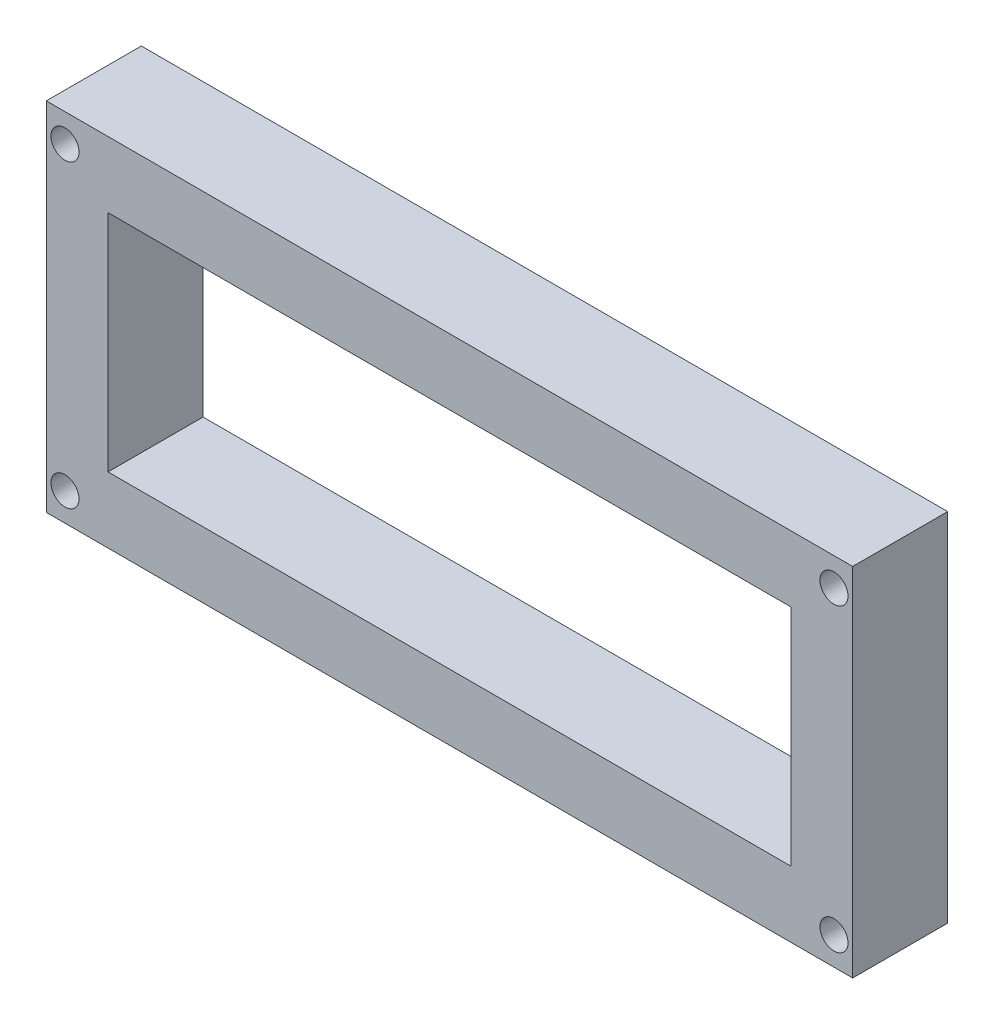
from build123d import *

# Parameters (mm, degrees)
SKETCH1_W           = 86.199999926
SKETCH1_H           = 38.1
SKETCH1_W_2         = 73
SKETCH1_H_2         = 24
BOSS_EXTRUDE1_DEPTH = 10.16
SKETCH2_R           = 1.5
CUT_EXTRUDE1_DEPTH  = 10.16


with BuildPart() as part:
    # Sketch1 → Boss-Extrude1 (new body)
    with BuildSketch(Plane.XY):
        Rectangle(SKETCH1_W, SKETCH1_H)
        Rectangle(SKETCH1_W_2, SKETCH1_H_2, mode=Mode.SUBTRACT)
    extrude(amount=BOSS_EXTRUDE1_DEPTH)

    # Sketch2 → Cut-Extrude1 (cut)
    with BuildSketch(Plane.XY.offset(10.16)):
        with Locations((41.099999963, 16.05)):
            Circle(SKETCH2_R)
        with Locations(Location((-41.099999963, 16.05, 0), (0, 0, 180))):
            Circle(SKETCH2_R)
        with Locations((-41.099999963, -16.05)):
            Circle(SKETCH2_R)
        with Locations(Location((41.099999963, -16.05, 0), (0, 0, 180))):
            Circle(SKETCH2_R)
    extrude(amount=-CUT_EXTRUDE1_DEPTH, mode=Mode.SUBTRACT)


solid = part.part
